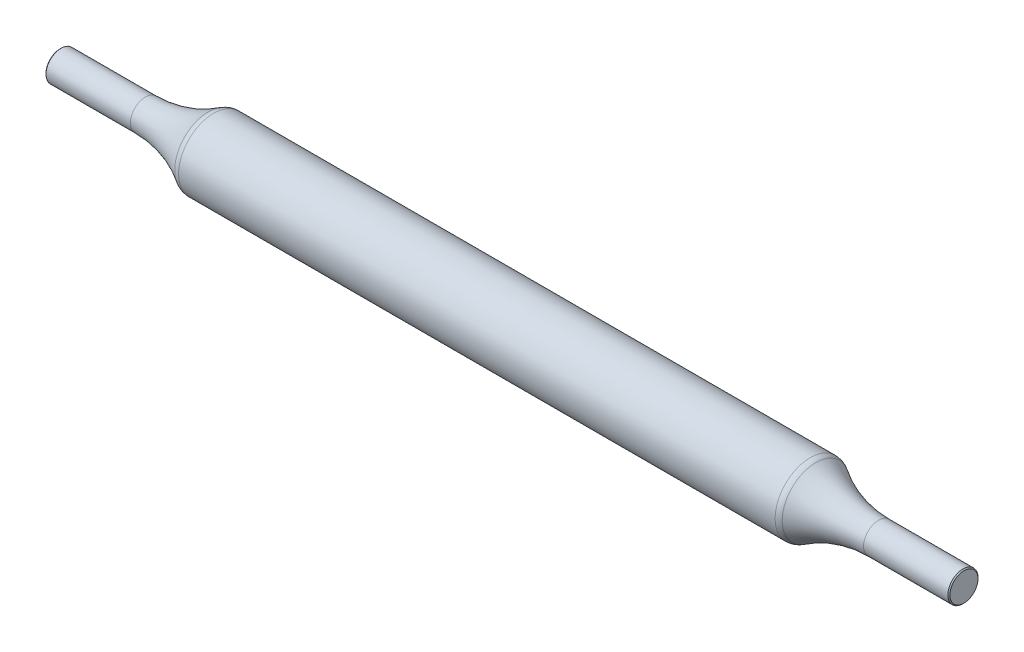
from build123d import *

# Parameters (mm, degrees)
FILLET1_R     = 0.5
CHAMFER1_SIZE = 0.05


with BuildPart() as part:
    # Sketch1 → Revolve1 (revolve)
    with BuildSketch(Plane.XY, mode=Mode.PRIVATE) as revolve1_sk:
        with BuildLine():
            Line((-22.5, 0), (22.5, 0))
            Line((22.5, 0), (22.5, 0.75))
            Line((22.5, 0.75), (18.25, 0.75))
            ThreePointArc((18.25, 0.75), (16.549816186, 1.005652606), (15, 1.75))
            Line((15, 1.75), (-15, 1.75))
            ThreePointArc((-15, 1.75), (-16.549816186, 1.005652606), (-18.25, 0.75))
            Line((-18.25, 0.75), (-22.5, 0.75))
            Line((-22.5, 0.75), (-22.5, 0))
        make_face()
    revolve(revolve1_sk.sketch.rotate(Axis((-22.5, 0, 0), (1, 0, 0)), 180), axis=Axis((-22.5, 0, 0), (1, 0, 0)))

    # Fillet1
    fillet1_edges = [part.edges().sort_by_distance(p)[0] for p in [
        (-15, 1.75, 0),
        (15, 1.75, 0),
    ]]
    fillet(fillet1_edges, radius=FILLET1_R)

    # Chamfer1
    chamfer1_edges = [part.edges().sort_by_distance(p)[0] for p in [
        (-22.5, 0.75, 0),
        (22.5, 0.75, 0),
    ]]
    chamfer(chamfer1_edges, length=CHAMFER1_SIZE)


solid = part.part
